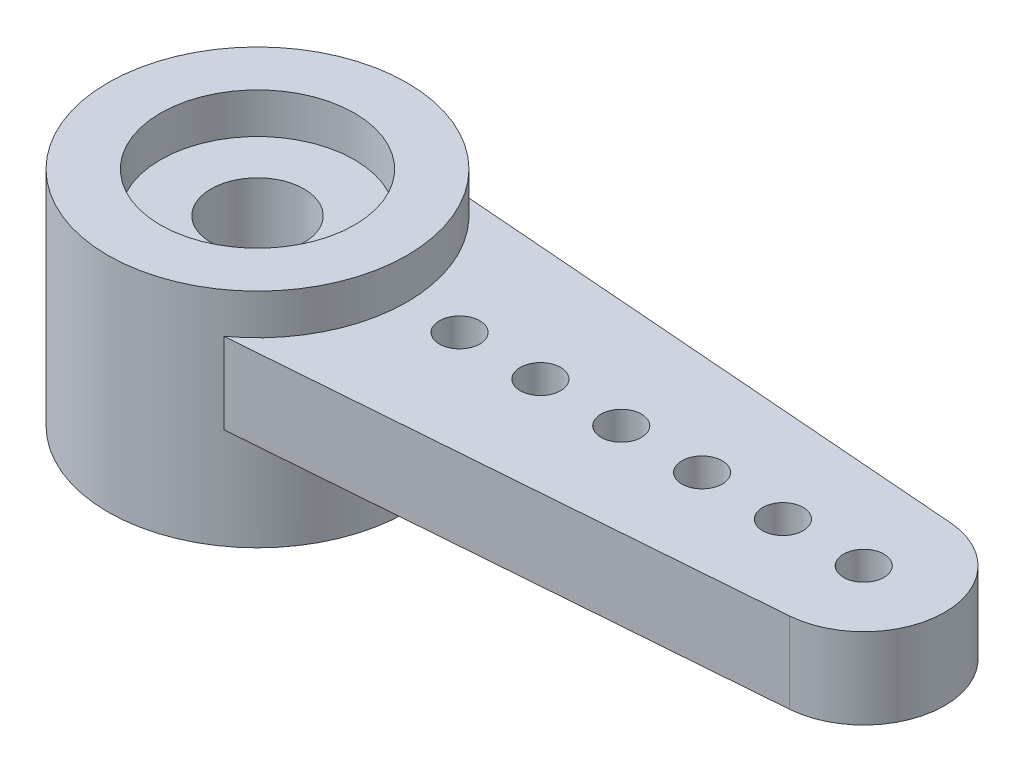
from build123d import *

# Parameters (mm, degrees)
BOSS_EXTRU_1_START = -3
ESQUISSE2_R        = 0.5
BOSS_EXTRU_1_DEPTH = 2


with BuildPart() as part:
    # Esquisse1 → Révolution1 (revolve)
    with BuildSketch(Plane.XY, mode=Mode.PRIVATE) as r_volution1_sk:
        Polygon((-2.4, 0), (-2.4, 3), (-1.15, 3), (-1.15, 4.5), (-2.4, 4.5), (-2.4, 5.5), (-3.7, 5.5), (-3.7, 0), align=None)
    revolve(r_volution1_sk.sketch.rotate(Axis((0, 0, 0), (0, 1, 0)), 270), axis=Axis((0, 0, 0), (0, 1, 0)))

    # Esquisse2 → Boss.-Extru.1 (add)
    with BuildSketch(Plane(origin=(0, 5.5, 0), x_dir=(1, 0, 0), z_dir=(0, 1, 0)).offset(BOSS_EXTRU_1_START)):
        with BuildLine():
            Line((2.165640783, 3), (15.15443587, 1.994028476))
            ThreePointArc((15.15443587, 1.994028476), (17, 0), (15.15443587, -1.994028476))
            Line((15.15443587, -1.994028476), (2.165640783, -3))
            ThreePointArc((2.165640783, -3), (3.7, 0), (2.165640783, 3))
        make_face()
        with Locations(Location((15, 0, 0), (0, 0, 270))):
            Circle(ESQUISSE2_R, mode=Mode.SUBTRACT)
        with Locations(Location((13, 0, 0), (0, 0, 270))):
            Circle(ESQUISSE2_R, mode=Mode.SUBTRACT)
        with Locations(Location((11, 0, 0), (0, 0, 270))):
            Circle(ESQUISSE2_R, mode=Mode.SUBTRACT)
        with Locations(Location((9, 0, 0), (0, 0, 270))):
            Circle(ESQUISSE2_R, mode=Mode.SUBTRACT)
        with Locations(Location((7, 0, 0), (0, 0, 270))):
            Circle(ESQUISSE2_R, mode=Mode.SUBTRACT)
        with Locations(Location((5, 0, 0), (0, 0, 270))):
            Circle(ESQUISSE2_R, mode=Mode.SUBTRACT)
    extrude(amount=BOSS_EXTRU_1_DEPTH)


solid = part.part
